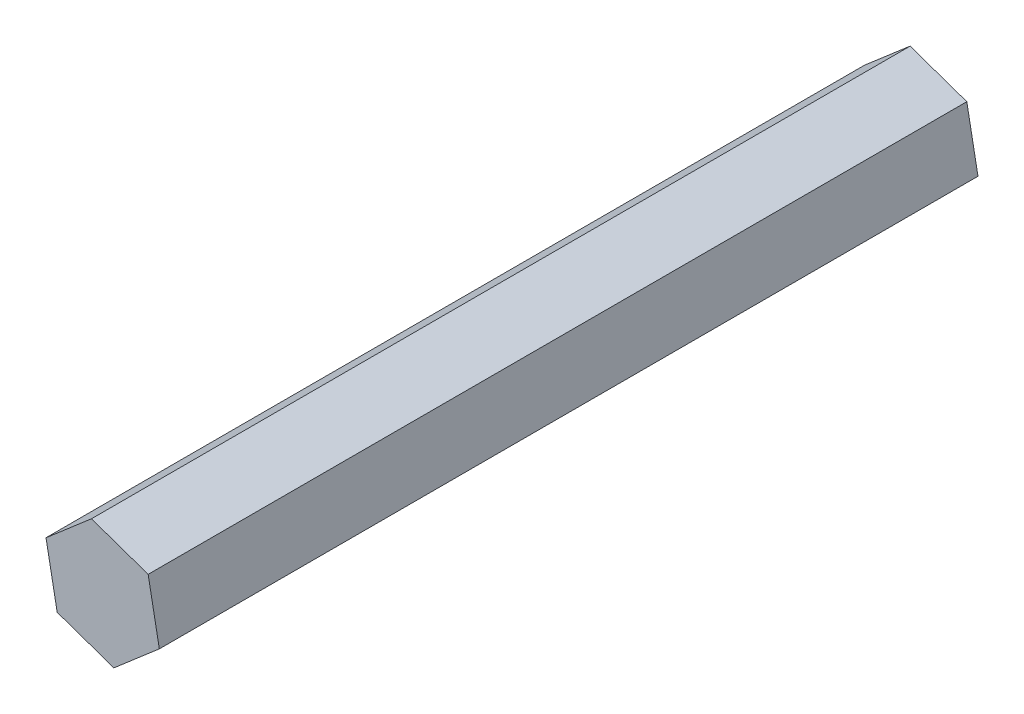
from build123d import *

# Parameters (mm, degrees)
BOSS_EXTRUDE1_DEPTH = 100


with BuildPart() as part:
    # Sketch1 → Boss-Extrude1 (new body)
    with BuildSketch(Plane.XY):
        Polygon((5.554760727, 4.78622676), (-1.367613599, 7.203677282), (-6.922374326, 2.417450522), (-5.554760727, -4.78622676), (1.367613599, -7.203677282), (6.922374326, -2.417450522), align=None)
    extrude(amount=BOSS_EXTRUDE1_DEPTH)


solid = part.part
